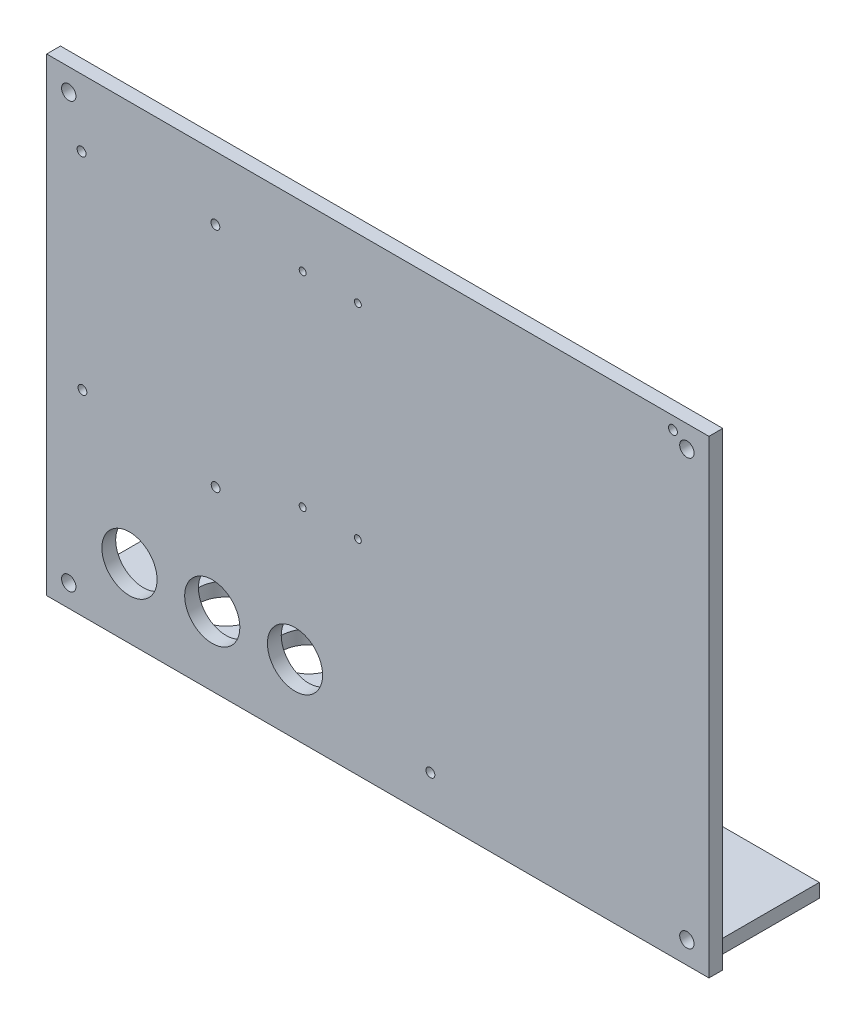
from build123d import *

# Parameters (mm, degrees)
ESQUISSE1_W             = 240
ESQUISSE1_H             = 170
BOSS_EXTRU_1_DEPTH      = 5
ESQUISSE2_R             = 1.6
ESQUISSE2_R_2           = 1.5999968
ESQUISSE2_R_3           = 1.607820406
ESQUISSE2_R_4           = 1.25
ENL_V_MAT_EXTRU_1_DEPTH = 5
ESQUISSE3_R             = 1.6
ENL_V_MAT_EXTRU_2_DEPTH = 5
ESQUISSE4_R             = 2.6
ENL_V_MAT_EXTRU_3_DEPTH = 5
ESQUISSE6_W             = 230
ESQUISSE6_H             = 5
BOSS_EXTRU_2_DEPTH      = 40
ESQUISSE8_R             = 10
ENL_V_MAT_EXTRU_4_DEPTH = 5
ESQUISSE9_R             = 10
ENL_V_MAT_EXTRU_5_DEPTH = 10


with BuildPart() as part:
    # Esquisse1 → Boss.-Extru.1 (new body)
    with BuildSketch(Plane.XY):
        with Locations((38.235058845, -76.154688976)):
            Rectangle(ESQUISSE1_W, ESQUISSE1_H)
    extrude(amount=BOSS_EXTRU_1_DEPTH)

    # Esquisse2 → Enlèv. mat.-Extru.1 (cut)
    with BuildSketch(Plane(origin=(0, 0, 0), x_dir=(-1, 0, 0), z_dir=(0, 0, -1))):
        with Locations((-145.2, 4.345311024)):
            Circle(ESQUISSE2_R)
        with Locations((20.538736773, -96.465756273)):
            Circle(ESQUISSE2_R_2)
        with Locations((68.798736773, -90.115756273)):
            Circle(ESQUISSE2_R_2)
        with Locations((69.128665464, -15.430898976)):
            Circle(ESQUISSE2_R_3)
        with Locations((20.632685464, -14.154688976)):
            Circle(ESQUISSE2_R_3)
        with Locations((-31, -87)):
            Circle(ESQUISSE2_R_4)
        with Locations((-11, -87)):
            Circle(ESQUISSE2_R_4)
        with Locations((-31, -13)):
            Circle(ESQUISSE2_R_4)
        with Locations((-11, -13)):
            Circle(ESQUISSE2_R_4)
    extrude(amount=-ENL_V_MAT_EXTRU_1_DEPTH, mode=Mode.SUBTRACT)

    # Esquisse3 → Enlèv. mat.-Extru.2 (cut)
    with BuildSketch(Plane.XY.offset(5)):
        with Locations((57.3, -147.154688976)):
            Circle(ESQUISSE3_R)
    extrude(amount=-ENL_V_MAT_EXTRU_2_DEPTH, mode=Mode.SUBTRACT)

    # Esquisse4 → Enlèv. mat.-Extru.3 (cut)
    with BuildSketch(Plane(origin=(0, 0, 0), x_dir=(-1, 0, 0), z_dir=(0, 0, -1))):
        with Locations((73.764941155, -153.154688976)):
            Circle(ESQUISSE4_R)
        with Locations((-150.235058845, -153.154688976)):
            Circle(ESQUISSE4_R)
        with Locations((-150.235058845, 0.845311024)):
            Circle(ESQUISSE4_R)
        with Locations((73.764941155, 0.845311024)):
            Circle(ESQUISSE4_R)
    extrude(amount=-ENL_V_MAT_EXTRU_3_DEPTH, mode=Mode.SUBTRACT)

    # Esquisse6 → Boss.-Extru.2 (add)
    with BuildSketch(Plane(origin=(0, 0, 0), x_dir=(-1, 0, 0), z_dir=(0, 0, -1))):
        with Locations((-38.235058845, -158.654688976)):
            Rectangle(ESQUISSE6_W, ESQUISSE6_H)
    extrude(amount=BOSS_EXTRU_2_DEPTH)

    # Esquisse8 → Enlèv. mat.-Extru.4 (cut)
    with BuildSketch(Plane.XZ.offset(161.154688976)):
        with Locations(Location((-41.764941155, -20, 0), (0, 0, 270))):
            Circle(ESQUISSE8_R)
        with Locations(Location((-11.764941155, -20, 0), (0, 0, 270))):
            Circle(ESQUISSE8_R)
        with Locations(Location((18.235058845, -20, 0), (0, 0, 270))):
            Circle(ESQUISSE8_R)
    extrude(amount=-ENL_V_MAT_EXTRU_4_DEPTH, mode=Mode.SUBTRACT)

    # Esquisse9 → Enlèv. mat.-Extru.5 (cut)
    with BuildSketch(Plane(origin=(0, 0, 0), x_dir=(-1, 0, 0), z_dir=(0, 0, -1))):
        with Locations((51.764941155, -136.154688976)):
            Circle(ESQUISSE9_R)
        with Locations((21.764941155, -136.154688976)):
            Circle(ESQUISSE9_R)
        with Locations((-8.235058845, -136.154688976)):
            Circle(ESQUISSE9_R)
    extrude(amount=-ENL_V_MAT_EXTRU_5_DEPTH, mode=Mode.SUBTRACT)


solid = part.part
